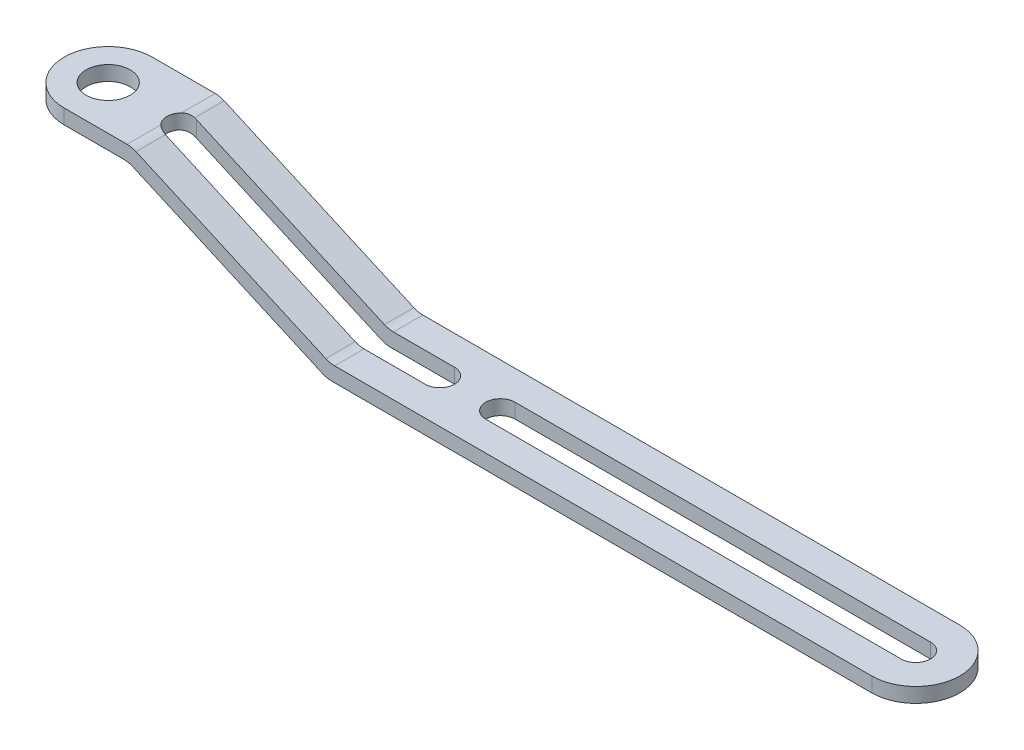
from build123d import *

# Parameters (mm, degrees)
SKETCH1_R           = 3
BOSS_EXTRUDE1_DEPTH = 14
SKETCH2_W           = 6
SKETCH2_H           = 12
CUT_EXTRUDE1_DEPTH  = 108.591821251


with BuildPart() as part:
    # Sketch1 → Boss-Extrude1 (new body)
    # profile 1 of 2: a face of its own
    with BuildSketch(Plane(origin=(0, 0, 0), x_dir=(1, 0, 0), z_dir=(0, 1, 0))):
        with BuildLine():
            Line((100, 6), (-10, 6))
            ThreePointArc((-10, 6), (-16, 0), (-10, -6))
            Line((-10, -6), (100, -6))
            ThreePointArc((100, -6), (106, 0), (100, 6))
        make_face()
        with Locations(Location((-10, 0, 0), (0, 0, 90))):
            Circle(SKETCH1_R, mode=Mode.SUBTRACT)
        with BuildLine():
            ThreePointArc((100, -2), (102, 0), (100, 2))
            Line((100, 2), (0, 2))
            ThreePointArc((0, 2), (-2, 0), (0, -2))
            Line((0, -2), (100, -2))
        make_face(mode=Mode.SUBTRACT)
    # profile 2 of 2: a face of its own
    with BuildSketch(Plane(origin=(0, 0, 0), x_dir=(1, 0, 0), z_dir=(0, 1, 0))):
        with BuildLine():
            Line((43.420617055, 2), (35.173899985, 2))
            ThreePointArc((35.173899985, 2), (37.173899985, 0), (35.173899985, -2))
            Line((35.173899985, -2), (43.420617055, -2))
            ThreePointArc((43.420617055, -2), (41.420617055, 0), (43.420617055, 2))
        make_face()
    extrude(amount=BOSS_EXTRUDE1_DEPTH)

    # Sketch2 → Cut-Extrude1 (cut, through all)
    with BuildSketch(Plane.XY.offset(6)):
        with BuildLine():
            Line((-10, 0), (26.424428901, 0))
            ThreePointArc((26.424428901, 0), (25.801654438, 0.065353178), (25.206013503, 0.258565354))
            Line((25.206013503, 0.258565354), (-0.630442404, 11.741434646))
            ThreePointArc((-0.630442404, 11.741434646), (-1.226083339, 11.934646822), (-1.848857802, 12))
            Line((-1.848857802, 12), (-10, 12))
            Line((-10, 12), (-10, 0))
        make_face()
        with BuildLine():
            Line((26.848857802, 2), (100, 2))
            Line((100, 2), (100, 14))
            Line((100, 14), (-1.424428901, 14))
            ThreePointArc((-1.424428901, 14), (-0.801654438, 13.934646822), (-0.206013503, 13.741434646))
            Line((-0.206013503, 13.741434646), (25.630442404, 2.258565354))
            ThreePointArc((25.630442404, 2.258565354), (26.226083339, 2.065353178), (26.848857802, 2))
        make_face()
        with Locations((103, 8)):
            Rectangle(SKETCH2_W, SKETCH2_H)
        with Locations((-13, 6)):
            Rectangle(SKETCH2_W, SKETCH2_H)
    extrude(amount=-CUT_EXTRUDE1_DEPTH, mode=Mode.SUBTRACT)


solid = part.part
